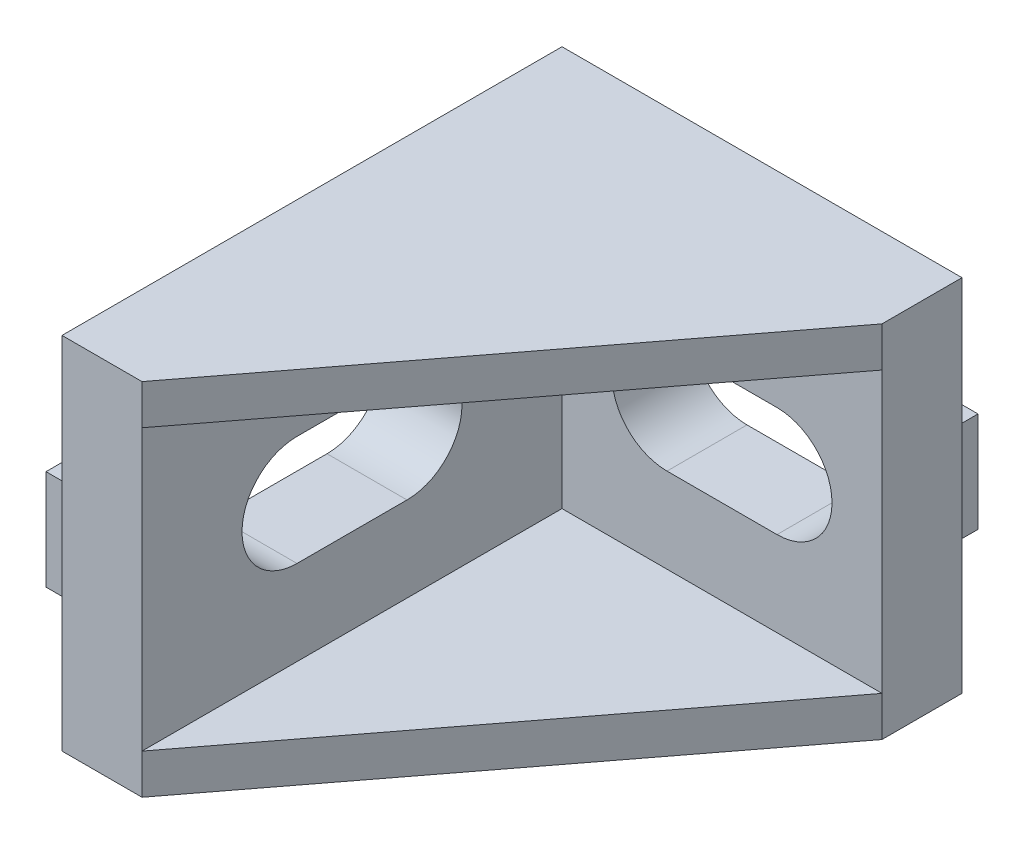
from build123d import *

# Parameters (mm, degrees)
SKETCH_1_W               = 20
SKETCH_1_H               = 18
EXTRUDE_1_DEPTH          = 25
SKETCH_2_W               = 16
SKETCH_2_H               = 14
CUT_EXTRUDE_1_DEPTH      = 21
CUT_EXTRUDE_2_DEPTH      = 32.320919527
CUT_EXTRUDE_2_DEPTH_BACK = 32.320919527
CUT_EXTRUDE_3_DEPTH      = 25.939927827
CUT_EXTRUDE_3_DEPTH_BACK = 25.939927827
CUT_EXTRUDE_4_DEPTH      = 32.016124839
CUT_EXTRUDE_4_DEPTH_BACK = 32.016124839
SKETCH_7_W               = 2
SKETCH_7_H               = 5
EXTRUDE_2_DEPTH          = 1
SKETCH_8_W               = 2
SKETCH_8_H               = 5
EXTRUDE_3_DEPTH          = 1


with BuildPart() as part:
    # 스케치1 → 보스-돌출1 (new body)
    with BuildSketch(Plane.XY):
        Rectangle(SKETCH_1_W, SKETCH_1_H)
    extrude(amount=EXTRUDE_1_DEPTH)

    # 스케치2 → 컷-돌출1 (cut)
    with BuildSketch(Plane.XY.offset(25)):
        with Locations((2, 0)):
            Rectangle(SKETCH_2_W, SKETCH_2_H)
    extrude(amount=-CUT_EXTRUDE_1_DEPTH, mode=Mode.SUBTRACT)

    # 스케치4 → 컷-돌출2 (cut, two sides: drawn at the far end of the back side and taken through both)
    with BuildSketch(Plane(origin=(0, -7, 0), x_dir=(1, 0, 0), z_dir=(0, 1, 0)).offset(-CUT_EXTRUDE_2_DEPTH_BACK)):
        Polygon((-6, -25), (10, -4), (10, -25), align=None)
    extrude(amount=CUT_EXTRUDE_2_DEPTH + CUT_EXTRUDE_2_DEPTH_BACK, mode=Mode.SUBTRACT)

    # 스케치5 → 컷-돌출3 (cut, two sides: drawn at the far end of the back side and taken through both)
    with BuildSketch(Plane.XY.offset(4).offset(-CUT_EXTRUDE_3_DEPTH_BACK)):
        with BuildLine():
            Line((-0.75, 2.75), (4.75, 2.75))
            ThreePointArc((4.75, 2.75), (7.5, 0), (4.75, -2.75))
            Line((4.75, -2.75), (-0.75, -2.75))
            ThreePointArc((-0.75, -2.75), (-3.5, 0), (-0.75, 2.75))
        make_face()
    extrude(amount=CUT_EXTRUDE_3_DEPTH + CUT_EXTRUDE_3_DEPTH_BACK, mode=Mode.SUBTRACT)

    # 스케치6 → 컷-돌출4 (cut, two sides: drawn at the far end of the back side and taken through both)
    with BuildSketch(Plane(origin=(-6, 0, 0), x_dir=(0, 0, -1), z_dir=(1, 0, 0)).offset(-CUT_EXTRUDE_4_DEPTH_BACK)):
        with BuildLine():
            Line((-17.25, 2.75), (-11.75, 2.75))
            ThreePointArc((-11.75, 2.75), (-9, 0), (-11.75, -2.75))
            Line((-11.75, -2.75), (-17.25, -2.75))
            ThreePointArc((-17.25, -2.75), (-20, 0), (-17.25, 2.75))
        make_face()
    extrude(amount=CUT_EXTRUDE_4_DEPTH + CUT_EXTRUDE_4_DEPTH_BACK, mode=Mode.SUBTRACT)

    # 스케치7 → 보스-돌출2 (add)
    with BuildSketch(Plane(origin=(0, 0, 0), x_dir=(-1, 0, 0), z_dir=(0, 0, -1))):
        with Locations((-8.8, 0)):
            Rectangle(SKETCH_7_W, SKETCH_7_H)
        with Locations((8.8, 0)):
            Rectangle(SKETCH_7_W, SKETCH_7_H)
    extrude(amount=EXTRUDE_2_DEPTH)

    # 스케치8 → 보스-돌출3 (add)
    with BuildSketch(Plane.ZY.offset(10)):
        with Locations((1.2, 0)):
            Rectangle(SKETCH_8_W, SKETCH_8_H)
        with Locations((23.8, 0)):
            Rectangle(SKETCH_8_W, SKETCH_8_H)
    extrude(amount=EXTRUDE_3_DEPTH)


solid = part.part
